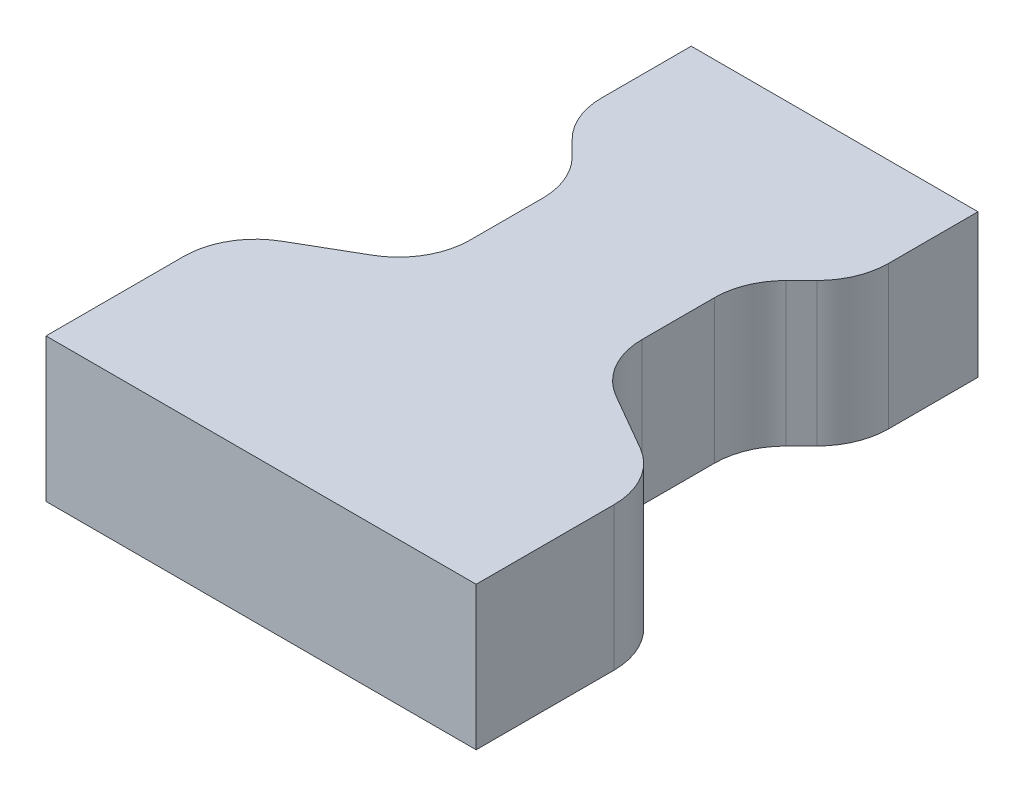
from build123d import *

# Parameters (mm, degrees)
BOSS_EXTRUDE1_DEPTH = 100


with BuildPart() as part:
    # Sketch1 → Boss-Extrude1 (new, symmetric)
    with BuildSketch(Plane(origin=(0, 0, 0), x_dir=(1, 0, 0), z_dir=(0, 1, 0))):
        with BuildLine():
            Line((-300, 0), (300, 0))
            Line((300, 0), (300, 192.264973081))
            ThreePointArc((300, 192.264973081), (286.602540378, 242.264973081), (250, 278.867513459))
            Line((250, 278.867513459), (170, 325.055534995))
            ThreePointArc((170, 325.055534995), (133.397459622, 361.658075373), (120, 411.658075373))
            Line((120, 411.658075373), (120, 512.501692217))
            ThreePointArc((120, 512.501692217), (127.612046749, 550.770035453), (149.289321881, 583.212370335))
            Line((149.289321881, 583.212370335), (170.710678119, 604.633726573))
            ThreePointArc((170.710678119, 604.633726573), (192.387953251, 637.076061455), (200, 675.344404691))
            Line((200, 675.344404691), (200, 800))
            Line((200, 800), (-200, 800))
            Line((-200, 800), (-200, 675.344404691))
            ThreePointArc((-200, 675.344404691), (-192.387953251, 637.076061455), (-170.710678119, 604.633726573))
            Line((-170.710678119, 604.633726573), (-149.289321881, 583.212370335))
            ThreePointArc((-149.289321881, 583.212370335), (-127.612046749, 550.770035453), (-120, 512.501692217))
            Line((-120, 512.501692217), (-120, 411.658075373))
            ThreePointArc((-120, 411.658075373), (-133.397459622, 361.658075373), (-170, 325.055534995))
            Line((-170, 325.055534995), (-250, 278.867513459))
            ThreePointArc((-250, 278.867513459), (-286.602540378, 242.264973081), (-300, 192.264973081))
            Line((-300, 192.264973081), (-300, 0))
        make_face()
    extrude(amount=BOSS_EXTRUDE1_DEPTH, both=True)


solid = part.part
